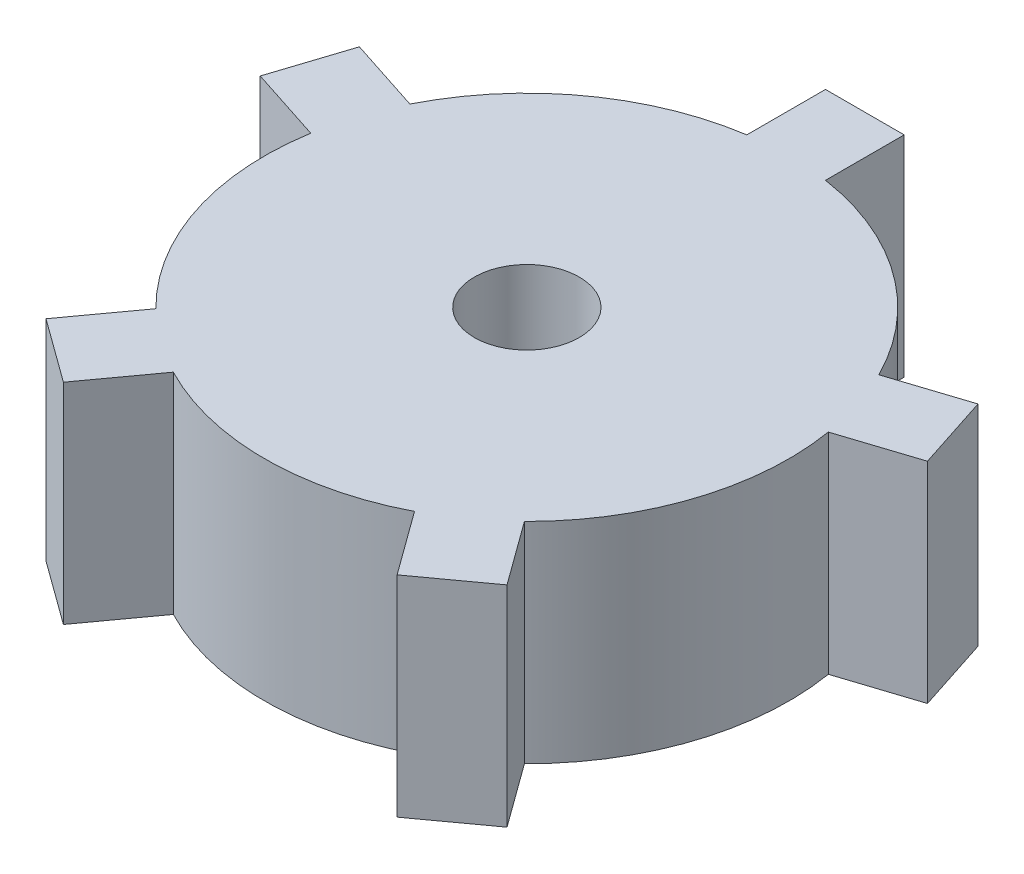
from build123d import *

# Parameters (mm, degrees)
SKETCH1_R           = 5
BOSS_EXTRUDE1_DEPTH = 20


with BuildPart() as part:
    # Sketch1 → Boss-Extrude1 (new body)
    with BuildSketch(Plane(origin=(0, 0, 0), x_dir=(1, 0, 0), z_dir=(0, 1, 0))):
        with BuildLine():
            Line((29.481516636, 13.522108771), (31.799144094, 6.389184898))
            Line((31.799144094, 6.389184898), (24.666220221, 4.071557441))
            ThreePointArc((24.666220221, 4.071557441), (23.776412907, -7.725424859), (17.562189929, -17.792399639))
            Line((17.562189929, -17.792399639), (21.970579321, -23.860027097))
            Line((21.970579321, -23.860027097), (15.902951863, -28.268416489))
            Line((15.902951863, -28.268416489), (11.494562471, -22.200789031))
            ThreePointArc((11.494562471, -22.200789031), (0, -25), (-11.494562471, -22.200789031))
            Line((-11.494562471, -22.200789031), (-15.902951863, -28.268416489))
            Line((-15.902951863, -28.268416489), (-21.970579321, -23.860027097))
            Line((-21.970579321, -23.860027097), (-17.562189929, -17.792399639))
            ThreePointArc((-17.562189929, -17.792399639), (-23.776412907, -7.725424859), (-24.666220221, 4.071557441))
            Line((-24.666220221, 4.071557441), (-31.799144094, 6.389184898))
            Line((-31.799144094, 6.389184898), (-29.481516636, 13.522108771))
            Line((-29.481516636, 13.522108771), (-22.348592764, 11.204481313))
            ThreePointArc((-22.348592764, 11.204481313), (-14.694631307, 20.225424859), (-3.75, 24.717149917))
            Line((-3.75, 24.717149917), (-3.75, 32.217149917))
            Line((-3.75, 32.217149917), (3.75, 32.217149917))
            Line((3.75, 32.217149917), (3.75, 24.717149917))
            ThreePointArc((3.75, 24.717149917), (14.694631307, 20.225424859), (22.348592764, 11.204481313))
            Line((22.348592764, 11.204481313), (29.481516636, 13.522108771))
        make_face()
        with Locations(Location((0, 0, 0), (0, 0, 270))):
            Circle(SKETCH1_R, mode=Mode.SUBTRACT)
    extrude(amount=BOSS_EXTRUDE1_DEPTH)


solid = part.part
